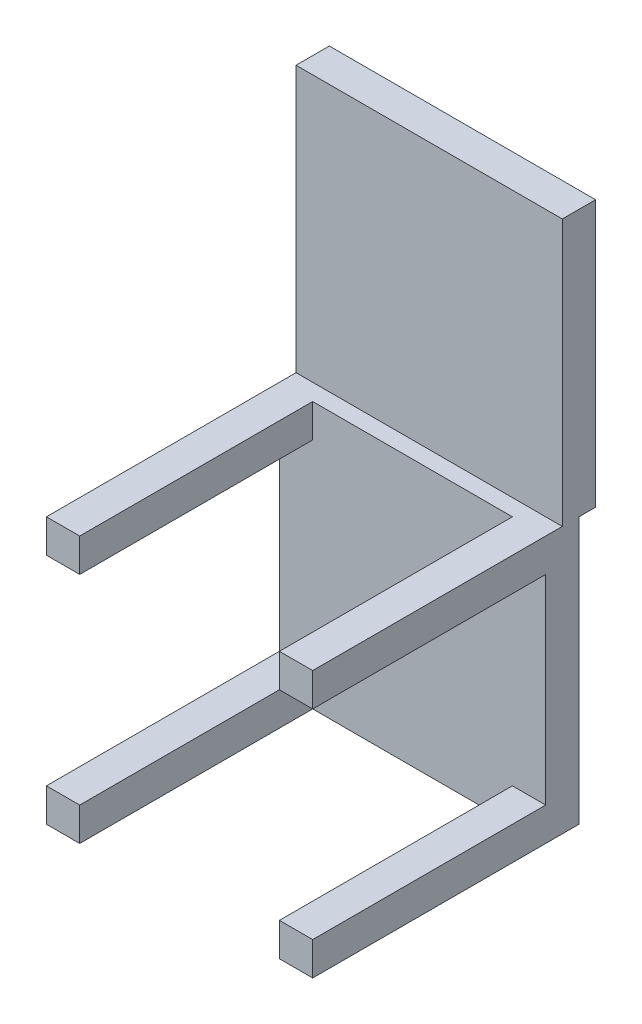
from build123d import *

# Parameters (mm, degrees)
SKETCH_1_W      = 400
SKETCH_1_H      = 400
EXTRUDE_1_DEPTH = 50
SKETCH_2_W      = 50
SKETCH_2_H      = 50
EXTRUDE_2_DEPTH = 400
SKETCH_3_W      = 50
SKETCH_3_H      = 50
EXTRUDE_3_DEPTH = 400
SKETCH_4_W      = 50
SKETCH_4_H      = 50
EXTRUDE_4_DEPTH = 400
SKETCH_5_W      = 50
SKETCH_5_H      = 50
EXTRUDE_5_DEPTH = 400
SKETCH_6_W      = 400
SKETCH_6_H      = 400
EXTRUDE_6_DEPTH = 50
SKETCH_7_W      = 400
SKETCH_7_H      = 50
EXTRUDE_7_DEPTH = 400


with BuildPart() as part:
    # 草图1 → 凸台-拉伸1 (new body)
    with BuildSketch(Plane.XY):
        Rectangle(SKETCH_1_W, SKETCH_1_H)
    extrude(amount=EXTRUDE_1_DEPTH)

    # 草图2 → 凸台-拉伸2 (add)
    with BuildSketch(Plane.XY):
        with Locations((175, 175)):
            Rectangle(SKETCH_2_W, SKETCH_2_H)
    extrude(amount=EXTRUDE_2_DEPTH)

    # 草图3 → 凸台-拉伸3 (add)
    with BuildSketch(Plane.XY):
        with Locations((-175, 175)):
            Rectangle(SKETCH_3_W, SKETCH_3_H)
    extrude(amount=EXTRUDE_3_DEPTH)

    # 草图4 → 凸台-拉伸4 (add)
    with BuildSketch(Plane.XY):
        with Locations((175, -175)):
            Rectangle(SKETCH_4_W, SKETCH_4_H)
    extrude(amount=EXTRUDE_4_DEPTH)

    # 草图5 → 凸台-拉伸5 (add)
    with BuildSketch(Plane.XY):
        with Locations((-175, -175)):
            Rectangle(SKETCH_5_W, SKETCH_5_H)
    extrude(amount=EXTRUDE_5_DEPTH)

    # 草图6 → 凸台-拉伸6 (add)
    with BuildSketch(Plane.XY):
        Rectangle(SKETCH_6_W, SKETCH_6_H)
    extrude(amount=EXTRUDE_6_DEPTH)

    # 草图7 → 凸台-拉伸7 (add)
    with BuildSketch(Plane(origin=(0, 200, 0), x_dir=(1, 0, 0), z_dir=(0, 1, 0))):
        Rectangle(SKETCH_7_W, SKETCH_7_H)
    extrude(amount=EXTRUDE_7_DEPTH)


solid = part.part
